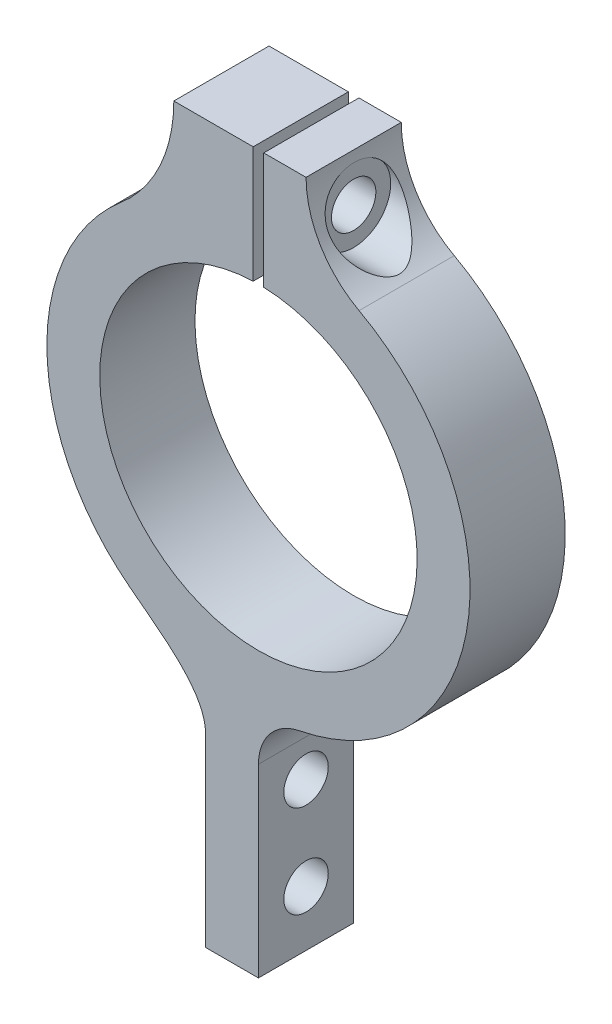
from build123d import *

# Parameters (mm, degrees)
MAIN_BODY_DEPTH      = 18
SKETCH14_W           = 4.2
SKETCH14_H           = 39
M8_CLEARANCE_HOLE2_D = 8.4
M8_CLEARANCE_HOLE3_D = 8.4
SKETCH27_R           = 7
CUT_EXTRUDE2_DEPTH   = 99.559772913


with BuildPart() as part:
    # Sketch1 → main body (new body)
    with BuildSketch(Plane.XY):
        with BuildLine():
            Line((0, -48.600411521), (0, -83.600411521))
            Line((0, -83.600411521), (-10, -83.600411521))
            Line((-10, -83.600411521), (-10, -48.600411521))
            add(Edge.make_bspline(
                [(-26.535230031, -29.931280748), (-20.948212629, -34.88438627), (-10, -40.904022772), (-10, -48.600411521)],
                knots=[0, 0, 0, 0, 1, 1, 1, 1], degree=3))
            ThreePointArc((-26.535230031, -29.931280748), (-39.998128482, 0.386934068), (-25.951219512, 30.43902439))
            ThreePointArc((-25.951219512, 30.43902439), (-18.607817439, 40.126684972), (-16, 52))
            Line((-16, 52), (-1, 52))
            Line((-1, 52), (-1, 29.983328701))
            ThreePointArc((-1, 29.983328701), (0, -30), (1, 29.983328701))
            Line((1, 29.983328701), (1, 52))
            Line((1, 52), (9, 52))
            ThreePointArc((9, 52), (11.695932832, 42.212959957), (19.02319236, 35.186903138))
            ThreePointArc((19.02319236, 35.186903138), (39.54457484, -6.018853774), (7.693084301, -39.253234949))
            ThreePointArc((7.693084301, -39.253234949), (2.170592409, -42.547452411), (0, -48.600411521))
        make_face()
    extrude(amount=MAIN_BODY_DEPTH)

    # Sketch14 → M8 Clearance Hole1 (revolve, cut)
    with BuildSketch(Plane(origin=(1, 43, 9), x_dir=(0, 0, 1), z_dir=(0, 1, 0))):
        with Locations((2.1, 19.5)):
            Rectangle(SKETCH14_W, SKETCH14_H)
    revolve(axis=Axis((-5.35, 43, 9), (1, 0, 0)), mode=Mode.SUBTRACT)

    # M8 Clearance Hole2 (through all)
    with Locations(Plane(origin=(1, 0, 0), x_dir=(0, 0, 1), z_dir=(1, 0, 0))):
        with Locations((9, -43)):
            Hole(M8_CLEARANCE_HOLE2_D / 2)

    # M8 Clearance Hole3 (through all)
    with Locations(Plane(origin=(0, 0, 0), x_dir=(0, 0, -1), z_dir=(1, 0, 0))):
        with Locations((-9, -55.600411521), (-9, -73.100411521)):
            Hole(M8_CLEARANCE_HOLE3_D / 2)

    # Sketch27 → Cut-Extrude2 (cut, through all)
    with BuildSketch(Plane(origin=(9, 0, 0), x_dir=(0, 0, -1), z_dir=(1, 0, 0))):
        with Locations(Location((-9, 43, 0), (0, 0, 270))):
            Circle(SKETCH27_R)
    extrude(amount=CUT_EXTRUDE2_DEPTH, mode=Mode.SUBTRACT)


solid = part.part
